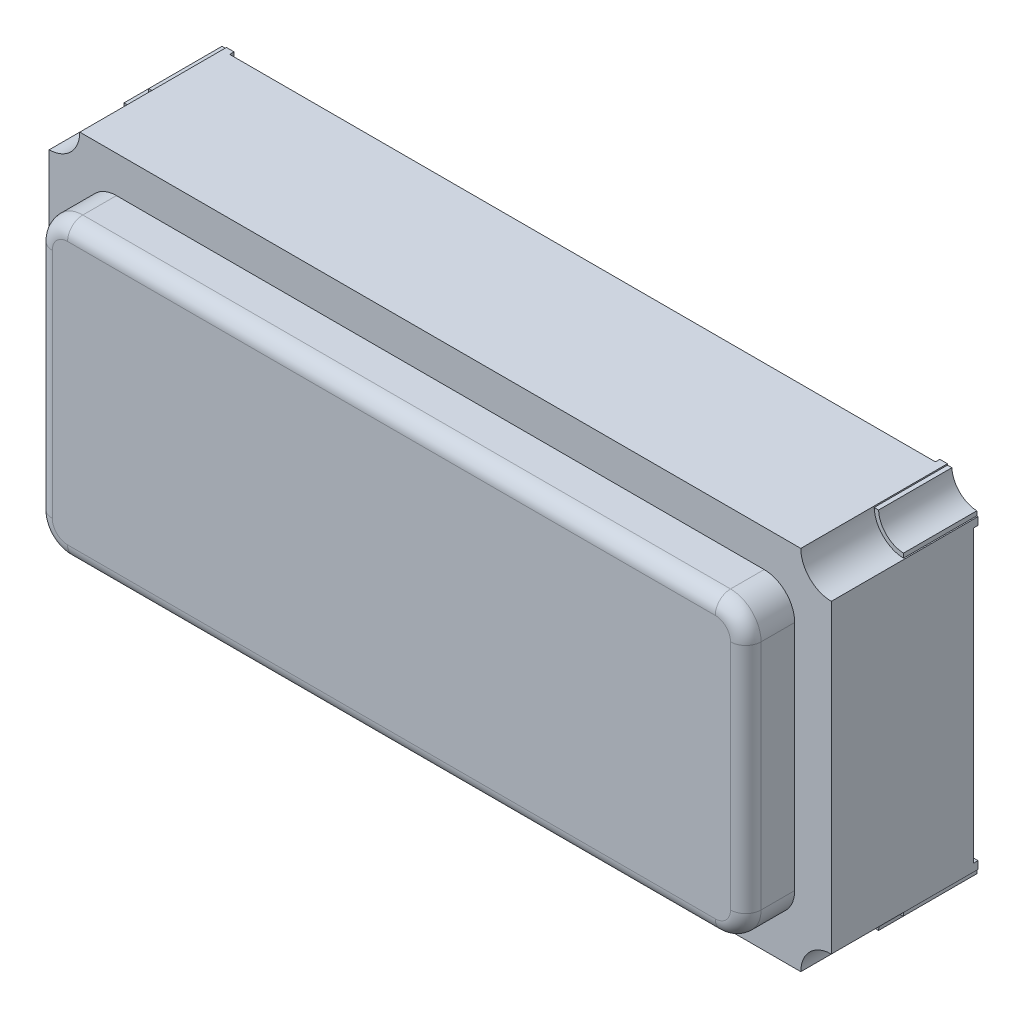
from build123d import *

# Parameters (mm, degrees)
SKETCH1_W               = 3.2
SKETCH1_H               = 1.5
BOSS_EXTRUDE1_DEPTH     = 0.564
BOSS_EXTRUDE2_DEPTH     = 0.018
MIRROR5_COPY_1_DEPTH    = 0.018
CUT_EXTRUDE1_DEPTH      = 2.854884363
CUT_EXTRUDE1_DEPTH_BACK = 2.854884363
BOSS_EXTRUDE3_START     = -0.282
BOSS_EXTRUDE3_DEPTH     = 0.3
MIRROR2_START           = -0.282
MIRROR2_COPY_1_DEPTH    = 0.3
BOSS_EXTRUDE4_START     = 0.018
BOSS_EXTRUDE4_DEPTH     = 0.018
SKETCH8_W               = 2.9
SKETCH8_H               = 1.2
BOSS_EXTRUDE5_DEPTH     = 0.2
FILLET1_R               = 0.125
FILLET2_R               = 0.0625
CHAMFER1_SIZE           = 0.25


with BuildPart() as part:
    # Sketch1 → Boss-Extrude1 (new body)
    with BuildSketch(Plane.XY):
        Rectangle(SKETCH1_W, SKETCH1_H)
    extrude(amount=BOSS_EXTRUDE1_DEPTH)

    # Sketch2 → Boss-Extrude2 (add)
    with BuildSketch(Plane(origin=(0, 0, 0), x_dir=(-1, 0, 0), z_dir=(0, 0, -1))):
        Polygon((0.8, -0.7), (1.44375, -0.7), (1.44375, -0.75), (1.6, -0.75), (1.6, -0.59375), (1.55, -0.59375), (1.55, 0), (0.8, 0), align=None)
    boss_extrude2 = extrude(amount=BOSS_EXTRUDE2_DEPTH)

    # Mirror4: Boss-Extrude2 across plane
    add(boss_extrude2.mirror(Plane.ZX))

    # Mirror5: Boss-Extrude2 across plane
    add(boss_extrude2.mirror(Plane(origin=(0, 0, 0), x_dir=(0, 0, 1), z_dir=(1, 0, 0))))

    # Mirror5 copy 1 sketch → Mirror5 copy 1 (add)
    with BuildSketch(Plane(origin=(0, 0, 0), x_dir=(1, 0, 0), z_dir=(0, 0, -1))):
        Polygon((0.8, -0.7), (1.44375, -0.7), (1.44375, -0.75), (1.6, -0.75), (1.6, -0.59375), (1.55, -0.59375), (1.55, 0), (0.8, 0), align=None)
    extrude(amount=MIRROR5_COPY_1_DEPTH)

    # Sketch3 → Cut-Extrude1 (cut, two sides: drawn at the far end of the back side and taken through both)
    with BuildSketch(Plane(origin=(0, 0, 0), x_dir=(-1, 0, 0), z_dir=(0, 0, -1)).offset(-CUT_EXTRUDE1_DEPTH_BACK)):
        with BuildLine():
            Line((1.6, 0.625), (1.6, 0.75))
            Line((1.6, 0.75), (1.475, 0.75))
            ThreePointArc((1.475, 0.75), (1.511611652, 0.661611652), (1.6, 0.625))
        make_face()
        with BuildLine():
            Line((-1.475, 0.75), (-1.6, 0.75))
            Line((-1.6, 0.75), (-1.6, 0.625))
            ThreePointArc((-1.6, 0.625), (-1.511611652, 0.661611652), (-1.475, 0.75))
        make_face()
        with BuildLine():
            Line((-1.6, -0.625), (-1.6, -0.75))
            Line((-1.6, -0.75), (-1.475, -0.75))
            ThreePointArc((-1.475, -0.75), (-1.511611652, -0.661611652), (-1.6, -0.625))
        make_face()
        with BuildLine():
            Line((1.6, -0.625), (1.6, -0.75))
            Line((1.6, -0.75), (1.475, -0.75))
            ThreePointArc((1.475, -0.75), (1.511611652, -0.661611652), (1.6, -0.625))
        make_face()
    extrude(amount=CUT_EXTRUDE1_DEPTH + CUT_EXTRUDE1_DEPTH_BACK, mode=Mode.SUBTRACT)

    # Sketch5 → Boss-Extrude3 (add)
    with BuildSketch(Plane(origin=(0, 0, 0), x_dir=(-1, 0, 0), z_dir=(0, 0, -1)).offset(BOSS_EXTRUDE3_START)):
        with BuildLine():
            Line((1.47510004, -0.745), (1.493116886, -0.745))
            ThreePointArc((1.493116886, -0.745), (1.524339574, -0.674339574), (1.595, -0.643116886))
            Line((1.595, -0.643116886), (1.595, -0.62510004))
            ThreePointArc((1.595, -0.62510004), (1.511611652, -0.661611652), (1.47510004, -0.745))
        make_face()
    boss_extrude3 = extrude(amount=BOSS_EXTRUDE3_DEPTH)

    # Mirror1: Boss-Extrude3 across plane
    add(boss_extrude3.mirror(Plane(origin=(0, 0, 0), x_dir=(0, 0, 1), z_dir=(1, 0, 0))))

    # Mirror2: Boss-Extrude3 across plane
    add(boss_extrude3.mirror(Plane.ZX))

    # Mirror2 copy 1 sketch → Mirror2 copy 1 (add)
    with BuildSketch(Plane(origin=(0, 0, 0), x_dir=(1, 0, 0), z_dir=(0, 0, -1)).offset(MIRROR2_START)):
        with BuildLine():
            Line((1.47510004, -0.745), (1.493116886, -0.745))
            ThreePointArc((1.493116886, -0.745), (1.524339574, -0.674339574), (1.595, -0.643116886))
            Line((1.595, -0.643116886), (1.595, -0.62510004))
            ThreePointArc((1.595, -0.62510004), (1.511611652, -0.661611652), (1.47510004, -0.745))
        make_face()
    extrude(amount=MIRROR2_COPY_1_DEPTH)

    # Sketch7 → Boss-Extrude4 (add)
    with BuildSketch(Plane.XY.offset(0.564).offset(BOSS_EXTRUDE4_START)):
        with BuildLine():
            Line((-1.475, 0.75), (1.475, 0.75))
            ThreePointArc((1.475, 0.75), (1.511611652, 0.661611652), (1.6, 0.625))
            Line((1.6, 0.625), (1.6, -0.625))
            ThreePointArc((1.6, -0.625), (1.511611652, -0.661611652), (1.475, -0.75))
            Line((1.475, -0.75), (-1.475, -0.75))
            ThreePointArc((-1.475, -0.75), (-1.511611652, -0.661611652), (-1.6, -0.625))
            Line((-1.6, -0.625), (-1.6, 0.625))
            ThreePointArc((-1.6, 0.625), (-1.511611652, 0.661611652), (-1.475, 0.75))
        make_face()
    extrude(amount=-BOSS_EXTRUDE4_DEPTH)

    # Sketch8 → Boss-Extrude5 (add)
    with BuildSketch(Plane.XY.offset(0.582)):
        Rectangle(SKETCH8_W, SKETCH8_H)
    extrude(amount=BOSS_EXTRUDE5_DEPTH)

    # Fillet1
    fillet1_edges = [part.edges().sort_by_distance(p)[0] for p in [
        (1.45, -0.6, 0.682),
        (1.45, 0.6, 0.682),
        (-1.45, 0.6, 0.682),
        (-1.45, -0.6, 0.682),
    ]]
    fillet(fillet1_edges, radius=FILLET1_R)

    # Fillet2
    fillet2_edges = [part.edges().sort_by_distance(p)[0] for p in [
        (-1.45, 0, 0.782),
        (0, 0.6, 0.782),
        (1.45, 0, 0.782),
        (0, -0.6, 0.782),
        (-1.413388348, -0.563388348, 0.782),
        (1.413388348, -0.563388348, 0.782),
        (1.413388348, 0.563388348, 0.782),
        (-1.413388348, 0.563388348, 0.782),
    ]]
    fillet(fillet2_edges, radius=FILLET2_R)

    # Chamfer1
    chamfer1_edges = [part.edges().sort_by_distance(p)[0] for p in [
        (-0.8, -0.7, -0.009),
    ]]
    chamfer(chamfer1_edges, length=CHAMFER1_SIZE)


solid = part.part
